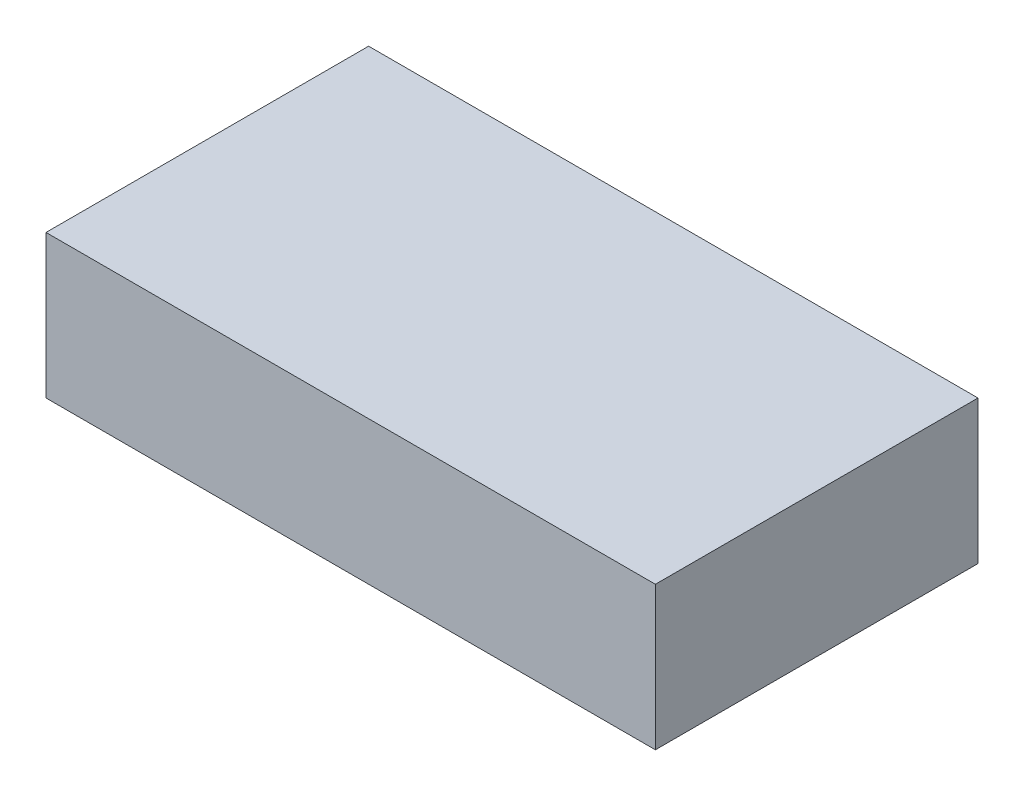
from build123d import *

# Parameters (mm, degrees)
SKETCH1_W           = 215.9
SKETCH1_H           = 114.3
BOSS_EXTRUDE1_DEPTH = 50.8


with BuildPart() as part:
    # Sketch1 → Boss-Extrude1 (new body)
    with BuildSketch(Plane(origin=(0, 0, 0), x_dir=(1, 0, 0), z_dir=(0, 1, 0))):
        Rectangle(SKETCH1_W, SKETCH1_H)
    extrude(amount=BOSS_EXTRUDE1_DEPTH)


solid = part.part
